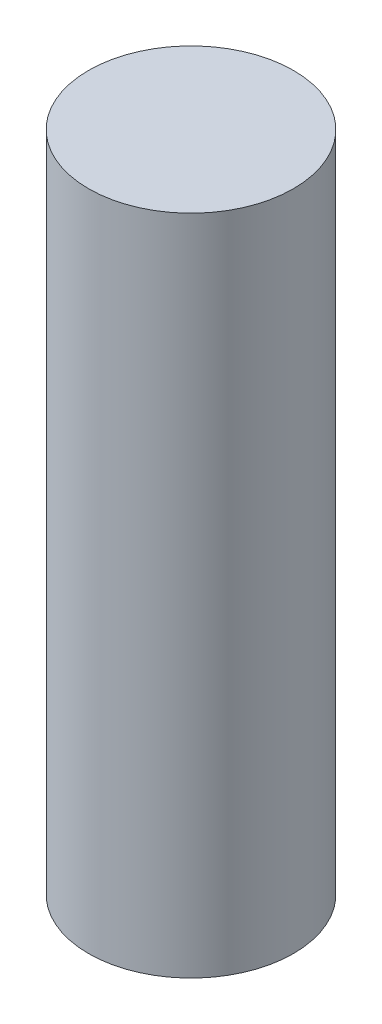
from build123d import *

# Parameters (mm, degrees)
ESBO_O2_R                = 12.375
RESSALTO_EXTRUS_O1_DEPTH = 80
CASCA2_T                 = 2.5


with BuildPart() as part:
    # Esboço2 → Ressalto-extrusão1 (new body)
    with BuildSketch(Plane(origin=(0, 0, 0), x_dir=(1, 0, 0), z_dir=(0, 1, 0))):
        with Locations(Location((0, 0, 0), (0, 0, 270))):
            Circle(ESBO_O2_R)
    extrude(amount=RESSALTO_EXTRUS_O1_DEPTH)

    # Casca2 (no face opened: a closed hollow body)
    add(offset(amount=-CASCA2_T, mode=Mode.PRIVATE), mode=Mode.SUBTRACT)


solid = part.part
